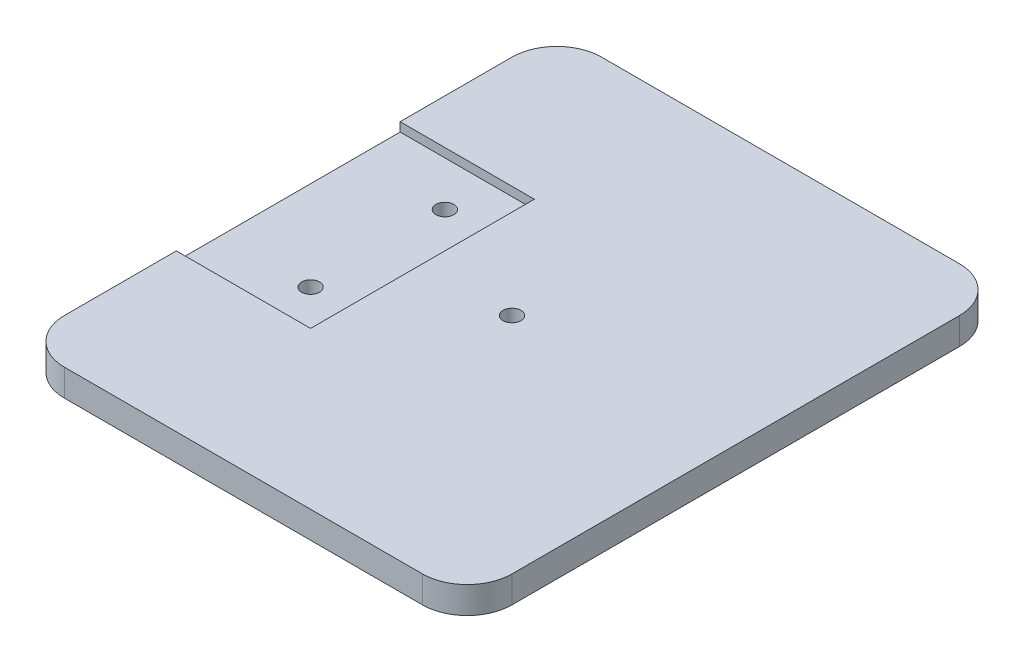
from build123d import *

# Parameters (mm, degrees)
SKETCH1_R           = 1
BOSS_EXTRUDE1_DEPTH = 3
SKETCH2_W           = 15
SKETCH2_H           = 25
CUT_EXTRUDE1_DEPTH  = 1


with BuildPart() as part:
    # Sketch1 → Boss-Extrude1 (new body)
    with BuildSketch(Plane(origin=(0, 0, 0), x_dir=(1, 0, 0), z_dir=(0, 1, 0))):
        with BuildLine():
            Line((-52.254901961, 26.274509804), (-12.254901961, 26.274509804))
            ThreePointArc((-12.254901961, 26.274509804), (-8.719368055, 24.81004371), (-7.254901961, 21.274509804))
            Line((-7.254901961, 21.274509804), (-7.254901961, -28.725490196))
            ThreePointArc((-7.254901961, -28.725490196), (-8.719368055, -32.261024102), (-12.254901961, -33.725490196))
            Line((-12.254901961, -33.725490196), (-52.254901961, -33.725490196))
            ThreePointArc((-52.254901961, -33.725490196), (-55.790435867, -32.261024102), (-57.254901961, -28.725490196))
            Line((-57.254901961, -28.725490196), (-57.254901961, 21.274509804))
            ThreePointArc((-57.254901961, 21.274509804), (-55.790435867, 24.81004371), (-52.254901961, 26.274509804))
        make_face()
        with Locations(Location((-32.254901961, -3.725490196, 0), (0, 0, 270))):
            Circle(SKETCH1_R, mode=Mode.SUBTRACT)
        with Locations(Location((-47.254901961, 3.774509804, 0), (0, 0, 270))):
            Circle(SKETCH1_R, mode=Mode.SUBTRACT)
        with Locations(Location((-47.254901961, -11.225490196, 0), (0, 0, 270))):
            Circle(SKETCH1_R, mode=Mode.SUBTRACT)
    extrude(amount=BOSS_EXTRUDE1_DEPTH)

    # Sketch2 → Cut-Extrude1 (cut)
    with BuildSketch(Plane(origin=(0, 3, 0), x_dir=(1, 0, 0), z_dir=(0, 1, 0))):
        with Locations((-49.754901961, -3.725490196)):
            Rectangle(SKETCH2_W, SKETCH2_H)
    extrude(amount=-CUT_EXTRUDE1_DEPTH, mode=Mode.SUBTRACT)


solid = part.part
